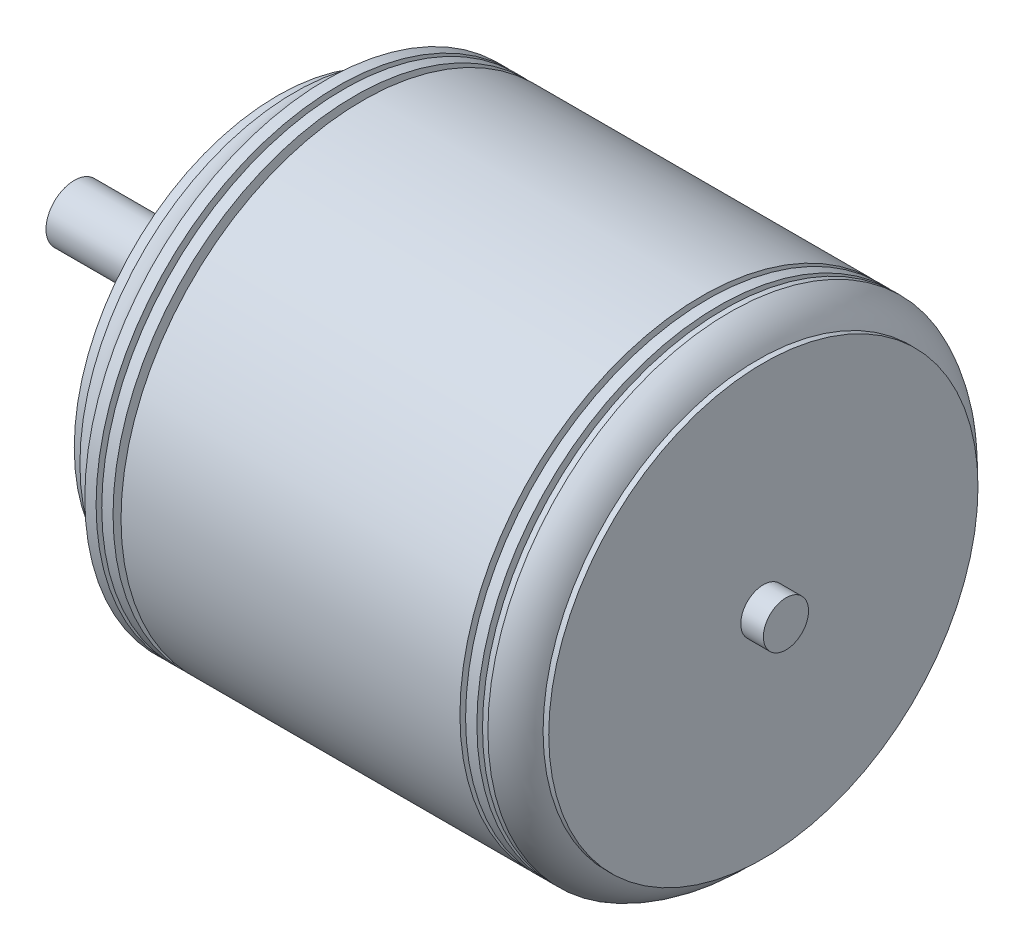
from build123d import *


with BuildPart() as part:
    # Sketch6 → Revolve1 (revolve)
    with BuildSketch(Plane.XY, mode=Mode.PRIVATE) as revolve1_sk:
        with BuildLine():
            Line((137, 2.5), (137, 0))
            Line((137, 0), (155, 0))
            Line((155, 0), (161.832507571, 0))
            Line((161.832507571, 0), (161.832507571, 13.982740363))
            Line((161.832507571, 13.982740363), (161.832507571, 21.4))
            Line((161.832507571, 21.4), (160.832507571, 21.4))
            Line((160.832507571, 21.4), (160.832507571, 20.4))
            Line((160.832507571, 20.4), (160.332507571, 20.4))
            Line((160.332507571, 20.4), (160.332507571, 21.4))
            Line((160.332507571, 21.4), (159.332507571, 21.4))
            ThreePointArc((159.332507571, 21.4), (158.150175861, 19.923922479), (156.5, 19))
            Line((156.5, 19), (156.5, 18))
            Line((156.5, 18), (155, 18))
            Line((155, 18), (155, 2.5))
            Line((155, 2.5), (137, 2.5))
        make_face()
        Polygon((161.832507571, 13.982740363), (161.832507571, 0), (162.539614352, 0), (162.539614352, 13.275633582), align=None)
        with BuildLine():
            Line((162.539614352, 13.275633582), (162.539614352, 0))
            Line((162.539614352, 0), (200, 0))
            Line((200, 0), (200, 2))
            Line((200, 2), (198, 2))
            Line((198, 2), (198, 19))
            Line((198, 19), (197.5, 19))
            ThreePointArc((197.5, 19), (196.497546245, 20.44777704), (195.016248395, 21.4))
            Line((195.016248395, 21.4), (194.539614352, 21.4))
            Line((194.539614352, 21.4), (194.539614352, 20.4))
            Line((194.539614352, 20.4), (194.039614352, 20.4))
            Line((194.039614352, 20.4), (194.039614352, 21.4))
            Line((194.039614352, 21.4), (193.039614352, 21.4))
            Line((193.039614352, 21.4), (193.039614352, 20.4))
            Line((193.039614352, 20.4), (192.539614352, 20.4))
            Line((192.539614352, 20.4), (192.539614352, 21.4))
            Line((192.539614352, 21.4), (162.539614352, 21.4))
            Line((162.539614352, 21.4), (162.539614352, 13.275633582))
        make_face()
    revolve(revolve1_sk.sketch.rotate(Axis((0, 0, 0), (1, 0, 0)), 90), axis=Axis((0, 0, 0), (1, 0, 0)))


solid = part.part
